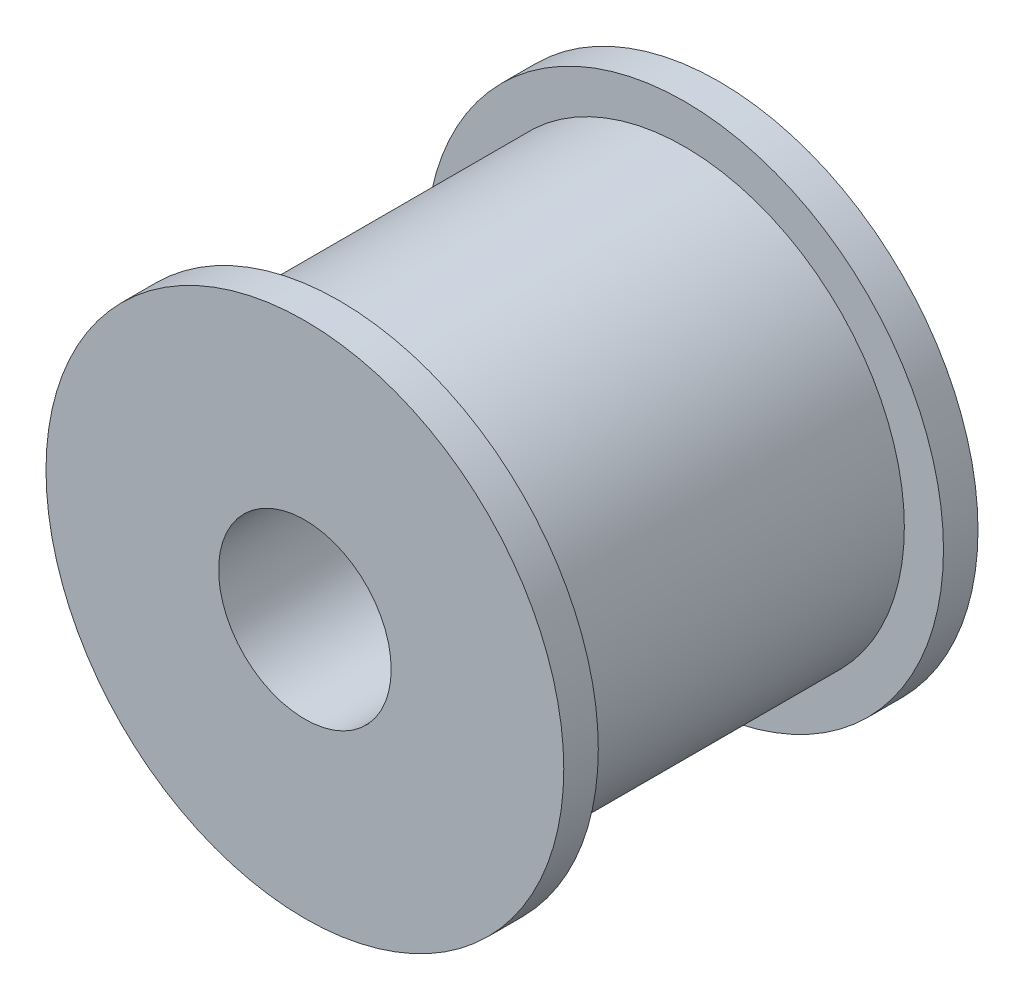
from build123d import *

# Parameters (mm, degrees)
SKETCH1_R           = 7.5
BOSS_EXTRUDE1_DEPTH = 6
SKETCH2_R           = 7.5
SKETCH2_R_2         = 6.366385485
CUT_EXTRUDE1_DEPTH  = 5
SKETCH3_R           = 2.5
CUT_EXTRUDE2_DEPTH  = 6


with BuildPart() as part:
    # Sketch1 → Boss-Extrude1 (new, symmetric)
    with BuildSketch(Plane.XY):
        Circle(SKETCH1_R)
    extrude(amount=BOSS_EXTRUDE1_DEPTH, both=True)

    # Sketch2 → Cut-Extrude1 (cut, symmetric)
    with BuildSketch(Plane.XY):
        Circle(SKETCH2_R)
        Circle(SKETCH2_R_2, mode=Mode.SUBTRACT)
    extrude(amount=CUT_EXTRUDE1_DEPTH, both=True, mode=Mode.SUBTRACT)

    # Sketch3 → Cut-Extrude2 (cut, symmetric)
    with BuildSketch(Plane.XY):
        Circle(SKETCH3_R)
    extrude(amount=CUT_EXTRUDE2_DEPTH, both=True, mode=Mode.SUBTRACT)


solid = part.part
